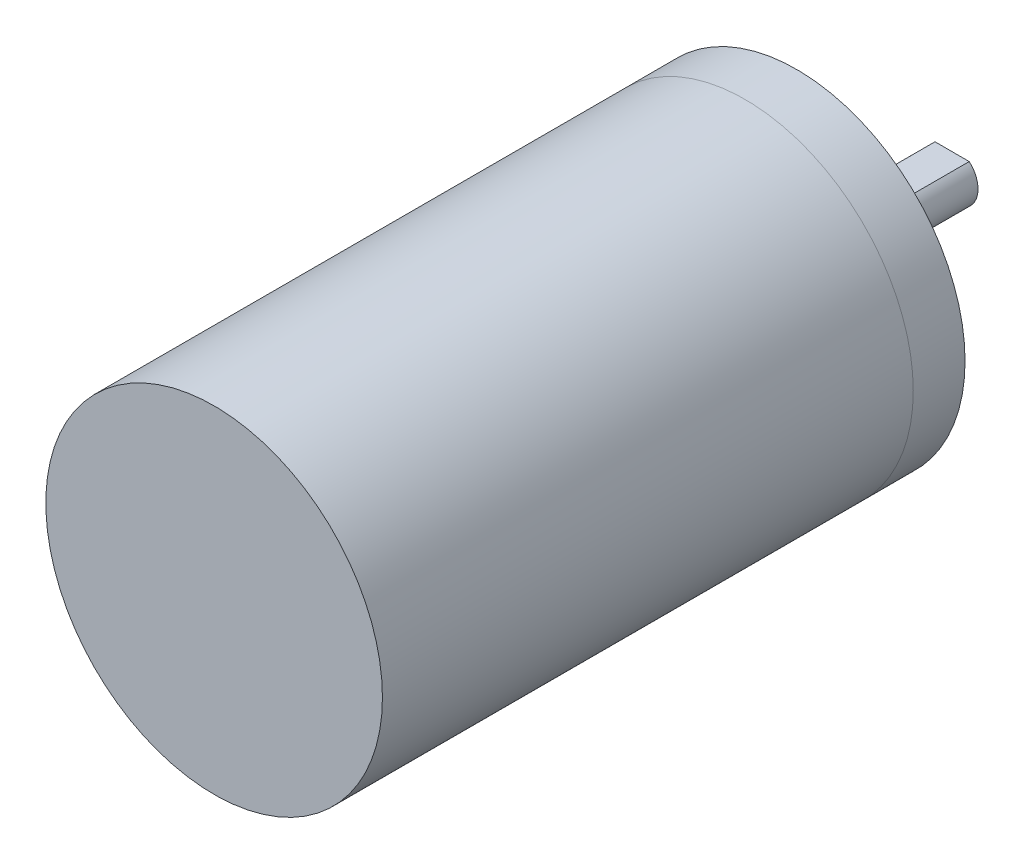
from build123d import *

# Parameters (mm, degrees)
SKETCH1_R                 = 13
MOTOR_BODY_DEPTH          = 45
BOSS_EXTRUDE2_DEPTH       = 12
BOSS_EXTRUDE3_DEPTH       = 4
F_3_0MM_DOWEL_HOLE2_D     = 3
F_3_0MM_DOWEL_HOLE2_DEPTH = 5
F_3_0MM_DOWEL_HOLE2_TIP   = 0.901290929


with BuildPart() as part:
    # Sketch1 → Motor Body (new body)
    with BuildSketch(Plane.XY):
        with Locations(Location((0, 0, 0), (0, 0, 180))):
            Circle(SKETCH1_R)
    extrude(amount=MOTOR_BODY_DEPTH)

    # Sketch2 → Boss-Extrude2 (add)
    with BuildSketch(Plane.XY):
        with BuildLine():
            ThreePointArc((2, 0), (1.822875656, 0.822875656), (1.322875656, 1.5))
            Line((1.322875656, 1.5), (-1.322875656, 1.5))
            ThreePointArc((-1.322875656, 1.5), (-0.822875656, -1.822875656), (2, 0))
        make_face()
    extrude(amount=-BOSS_EXTRUDE2_DEPTH)

    # Sketch2<3> → Boss-Extrude3 (add)
    with BuildSketch(Plane.XY):
        with BuildLine():
            ThreePointArc((2, 0), (1.822875656, 0.822875656), (1.322875656, 1.5))
            Line((1.322875656, 1.5), (-1.322875656, 1.5))
            ThreePointArc((-1.322875656, 1.5), (-0.822875656, -1.822875656), (2, 0))
        make_face()
        with BuildLine():
            Line((-1.322875656, 1.5), (1.322875656, 1.5))
            ThreePointArc((1.322875656, 1.5), (0, 2), (-1.322875656, 1.5))
        make_face()
    extrude(amount=-BOSS_EXTRUDE3_DEPTH)

    # Ø3.0mm Dowel Hole2
    with Locations(Plane(origin=(0, 0, 0), x_dir=(-1, 0, 0), z_dir=(0, 0, -1))):
        with Locations((-10, 0), (10, 0)):
            Hole(F_3_0MM_DOWEL_HOLE2_D / 2, depth=F_3_0MM_DOWEL_HOLE2_DEPTH)
            with Locations((0, 0, -(F_3_0MM_DOWEL_HOLE2_DEPTH + F_3_0MM_DOWEL_HOLE2_TIP / 2))):  # 118° drill point
                Cone(0, F_3_0MM_DOWEL_HOLE2_D / 2, F_3_0MM_DOWEL_HOLE2_TIP, mode=Mode.SUBTRACT)


solid = part.part
